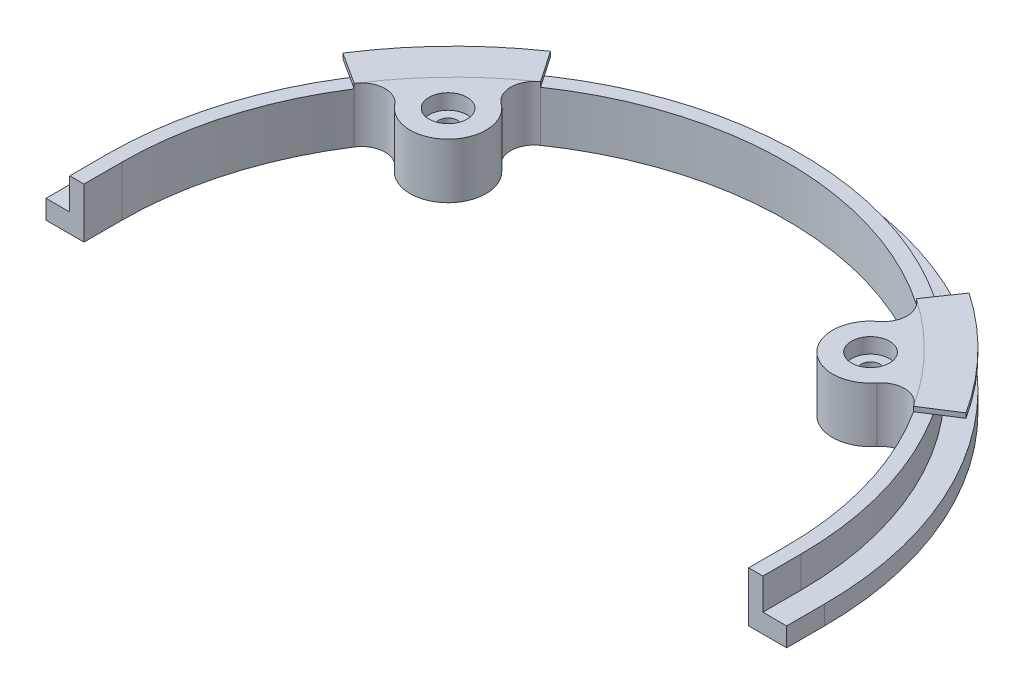
from build123d import *

# Parameters (mm, degrees)
BOSS_EXTRUDE1_DEPTH                     = 3.3
BOSS_EXTRUDE2_DEPTH                     = 2
BOSS_EXTRUDE3_DEPTH                     = 0.5
BOSS_EXTRUDE3_DEPTH_BACK                = 5.3
BOSS_EXTRUDE4_DEPTH                     = 0.5
CBORE_FOR_M2_PAN_HEAD_SCREW2_AT_2_COUNT = 2
CBORE_FOR_M2_PAN_HEAD_SCREW2_AT_2_PITCH = 44.490002881


with BuildPart() as part:
    # Sketch1 → Boss-Extrude1 (new body)
    with BuildSketch(Plane(origin=(0, 0, 0), x_dir=(1, 0, 0), z_dir=(0, 1, 0))):
        with BuildLine():
            Line((36.5, 0), (36.5, -4))
            Line((36.5, -4), (35, -4))
            Line((35, -4), (35, 0))
            ThreePointArc((35, 0), (0, 35), (-35, 0))
            Line((-35, 0), (-35, -4))
            Line((-35, -4), (-36.5, -4))
            Line((-36.5, -4), (-36.5, 0))
            ThreePointArc((-36.5, 0), (0, 36.5), (36.5, 0))
        make_face()
    extrude(amount=BOSS_EXTRUDE1_DEPTH)



with BuildPart() as body_2:
    # Sketch2 → Boss-Extrude2 (new body)
    with BuildSketch(Plane.XZ):
        with BuildLine():
            Line((-36.5, 0), (-36.5, 4))
            Line((-36.5, 4), (-39, 4))
            Line((-39, 4), (-39, 0))
            ThreePointArc((-39, 0), (0, -39), (39, 0))
            Line((39, 0), (39, 4))
            Line((39, 4), (36.5, 4))
            Line((36.5, 4), (36.5, 0))
            ThreePointArc((36.5, 0), (0, -36.5), (-36.5, 0))
        make_face()
        with BuildLine():
            Line((-36.5, 4), (-36.5, 0))
            ThreePointArc((-36.5, 0), (0, -36.5), (36.5, 0))
            Line((36.5, 0), (36.5, 4))
            Line((36.5, 4), (35, 4))
            Line((35, 4), (35, 0))
            ThreePointArc((35, 0), (0, -35), (-35, 0))
            Line((-35, 0), (-35, 4))
            Line((-35, 4), (-36.5, 4))
        make_face()
    extrude(amount=BOSS_EXTRUDE2_DEPTH)


with BuildPart() as part_1:
    add(part.part)

    add(body_2.part)  # Boss-Extrude3 merges body 2
    # Sketch3 → Boss-Extrude3 (add, two sides: drawn at the far end of the back side and taken through both)
    with BuildSketch(Plane(origin=(0, 3.3, 0), x_dir=(1, 0, 0), z_dir=(0, 1, 0)).offset(-BOSS_EXTRUDE3_DEPTH_BACK)):
        with BuildLine():
            ThreePointArc((-29.449739277, 18.913298404), (-27.468060754, 20.059376083), (-25.384192229, 19.111728585))
            ThreePointArc((-25.384192229, 19.111728585), (-19.374678674, 18.804835184), (-19.860783886, 24.802512938))
            ThreePointArc((-19.860783886, 24.802512938), (-20.870200446, 26.857171552), (-19.783774677, 28.872171022))
            ThreePointArc((-19.783774677, 28.872171022), (-25.115324207, 24.376638201), (-29.449739277, 18.913298404))
        make_face()
        with BuildLine():
            ThreePointArc((29.449739277, 18.913298404), (25.115324207, 24.376638201), (19.783774677, 28.872171022))
            ThreePointArc((19.783774677, 28.872171022), (20.870200446, 26.857171552), (19.860783886, 24.802512938))
            ThreePointArc((19.860783886, 24.802512938), (19.374678674, 18.804835184), (25.384192229, 19.111728585))
            ThreePointArc((25.384192229, 19.111728585), (27.468060754, 20.059376083), (29.449739277, 18.913298404))
        make_face()
    extrude(amount=BOSS_EXTRUDE3_DEPTH + BOSS_EXTRUDE3_DEPTH_BACK)

    # Sketch11 → CBORE for M2 Pan Head Screw2 (revolve, cut)
    with BuildSketch(Plane(origin=(-22.24500144, 3.8, -21.590736692), x_dir=(0, 0, 1), z_dir=(1, 0, 0))):
        Polygon((0, 0), (0, 30.600860619), (1, 30), (1, 1.6), (2, 1.6), (2, 0), align=None)
    cbore_for_m2_pan_head_screw2 = revolve(axis=Axis((-22.24500144, 10.15, -21.590736692), (0, -1, 0)), mode=Mode.SUBTRACT)

    # CBORE for M2 Pan Head Screw2 at 2: CBORE for M2 Pan Head Screw2 ×2
    with Locations(*[(i * CBORE_FOR_M2_PAN_HEAD_SCREW2_AT_2_PITCH, 0, 0) for i in range(1, CBORE_FOR_M2_PAN_HEAD_SCREW2_AT_2_COUNT)]):
        add(cbore_for_m2_pan_head_screw2, mode=Mode.SUBTRACT)


with BuildPart() as body_2_2:
    # Sketch9 → Boss-Extrude4 (new body)
    with BuildSketch(Plane(origin=(0, 3.3, 0), x_dir=(1, 0, 0), z_dir=(0, 1, 0))):
        with BuildLine():
            Line((-32.815423766, 21.074818222), (-30.71187096, 19.723868336))
            ThreePointArc((-30.71187096, 19.723868336), (-26.191695244, 25.421351267), (-20.631650735, 30.10954978))
            Line((-20.631650735, 30.10954978), (-22.044777498, 32.17184771))
            ThreePointArc((-22.044777498, 32.17184771), (-27.985646974, 27.16253971), (-32.815423766, 21.074818222))
        make_face()
        with BuildLine():
            Line((-30.71187096, 19.723868336), (-29.449739277, 18.913298404))
            ThreePointArc((-29.449739277, 18.913298404), (-25.115324207, 24.376638201), (-19.783774677, 28.872171022))
            Line((-19.783774677, 28.872171022), (-20.631650735, 30.10954978))
            ThreePointArc((-20.631650735, 30.10954978), (-26.191695244, 25.421351267), (-30.71187096, 19.723868336))
        make_face()
        with BuildLine():
            ThreePointArc((30.71187096, 19.723868336), (26.191695244, 25.421351267), (20.631650735, 30.10954978))
            Line((20.631650735, 30.10954978), (19.783774677, 28.872171022))
            ThreePointArc((19.783774677, 28.872171022), (25.115324207, 24.376638201), (29.449739277, 18.913298404))
            Line((29.449739277, 18.913298404), (30.71187096, 19.723868336))
        make_face()
        with BuildLine():
            Line((22.044777498, 32.17184771), (20.631650735, 30.10954978))
            ThreePointArc((20.631650735, 30.10954978), (26.191695244, 25.421351267), (30.71187096, 19.723868336))
            Line((30.71187096, 19.723868336), (32.815423766, 21.074818222))
            ThreePointArc((32.815423766, 21.074818222), (27.985646974, 27.16253971), (22.044777498, 32.17184771))
        make_face()
    extrude(amount=BOSS_EXTRUDE4_DEPTH)


solid = Compound([part_1.part, body_2_2.part])
